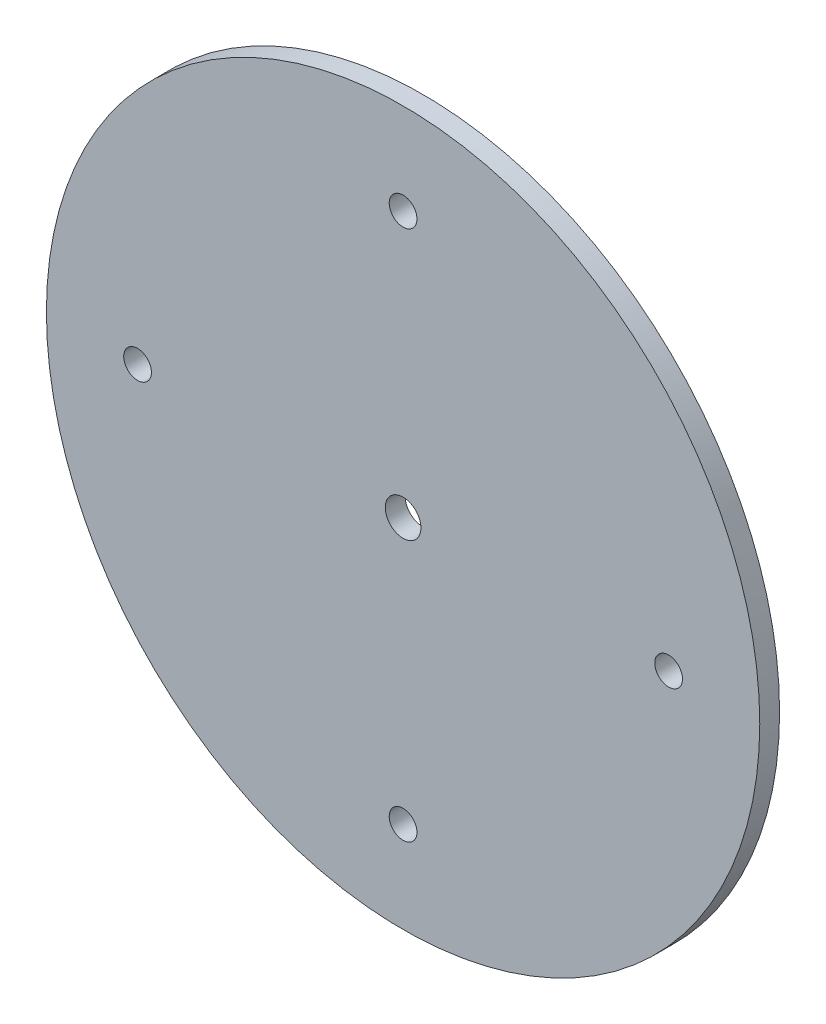
from build123d import *

# Parameters (mm, degrees)
SKETCH1_R           = 45
SKETCH1_R_2         = 2.25
SKETCH1_R_3         = 1.75
BOSS_EXTRUDE1_DEPTH = 2.5
SKETCH2_R           = 29.85
SKETCH2_R_2         = 12.65
BOSS_EXTRUDE2_DEPTH = 1


with BuildPart() as part:
    # Sketch1 → Boss-Extrude1 (new body)
    with BuildSketch(Plane.XY):
        Circle(SKETCH1_R)
        Circle(SKETCH1_R_2, mode=Mode.SUBTRACT)
        with Locations((0, 33.5)):
            Circle(SKETCH1_R_3, mode=Mode.SUBTRACT)
        with Locations((33.5, 0)):
            Circle(SKETCH1_R_3, mode=Mode.SUBTRACT)
        with Locations((0, -33.5)):
            Circle(SKETCH1_R_3, mode=Mode.SUBTRACT)
        with Locations((-33.5, 0)):
            Circle(SKETCH1_R_3, mode=Mode.SUBTRACT)
    extrude(amount=BOSS_EXTRUDE1_DEPTH)

    # Sketch2 → Boss-Extrude2 (add)
    with BuildSketch(Plane(origin=(0, 0, 0), x_dir=(-1, 0, 0), z_dir=(0, 0, -1))):
        Circle(SKETCH2_R)
        Circle(SKETCH2_R_2, mode=Mode.SUBTRACT)
    extrude(amount=BOSS_EXTRUDE2_DEPTH)


solid = part.part
